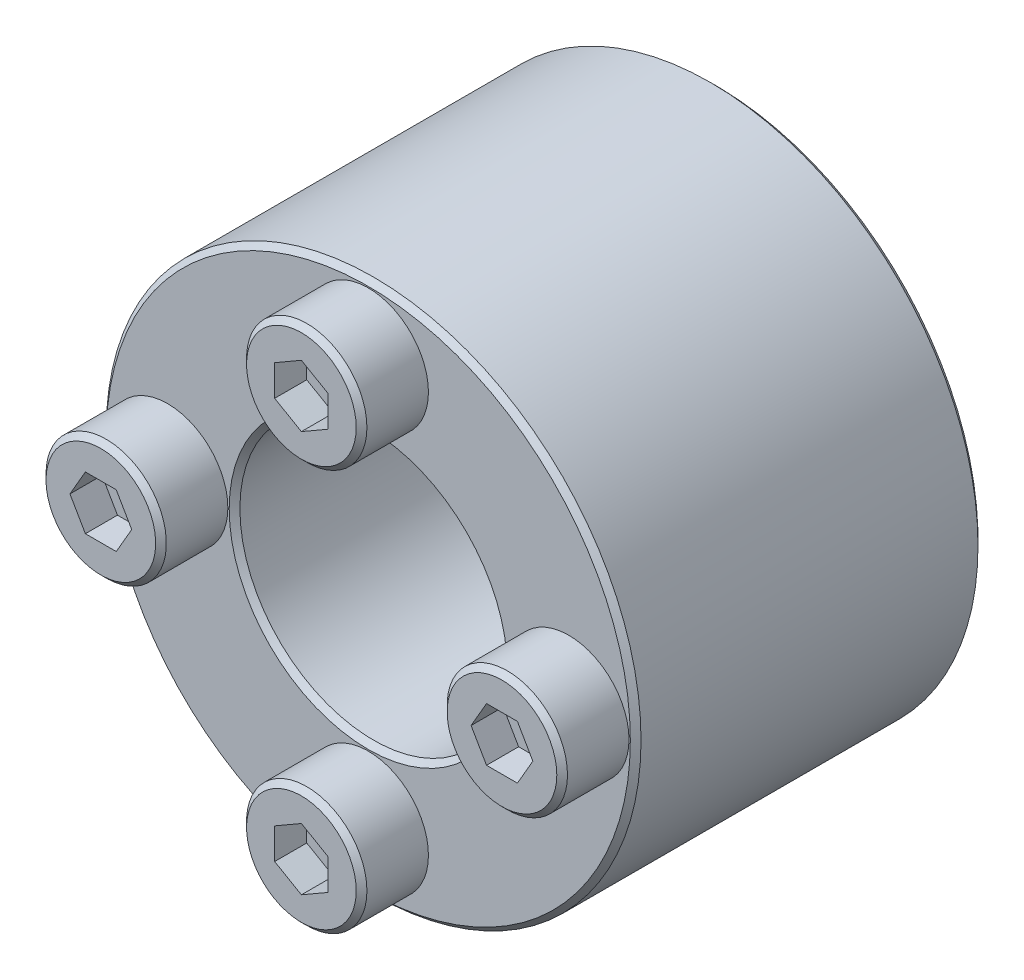
from build123d import *

# Parameters (mm, degrees)
SKETCH_1_W                  = 10
SKETCH_1_H                  = 13
SKETCH_2_R                  = 2.25
EXTRUDE_1_DEPTH             = 2.5
CUT_EXTRUDE_1_DEPTH         = 1.2
SKETCH_4_R                  = 2.25
EXTRUDE_2_DEPTH             = 2.5
CUT_EXTRUDE_2_DEPTH         = 1.2
SKETCH_6_R                  = 2.25
EXTRUDE_3_DEPTH             = 2.5
CUT_EXTRUDE_3_DEPTH         = 1.2
SKETCH_8_R                  = 2.25
EXTRUDE_4_DEPTH             = 2.5
CUT_EXTRUDE_4_DEPTH         = 1.2
SKETCH_10_W                 = 1.1
SKETCH_10_H                 = 11
SKETCH_11_W                 = 1.1
SKETCH_11_H                 = 11
SKETCH_12_W                 = 1.1
SKETCH_12_H                 = 11
SKETCH_13_W                 = 1.1
SKETCH_13_H                 = 11
HOLE_WIZARD_10_0_10_1_D     = 10
HOLE_WIZARD_10_0_10_1_DEPTH = 15.5
CHAMFER_1_SIZE              = 0.2


with BuildPart() as part:
    # 草图1 → 旋转1 (revolve)
    with BuildSketch(Plane.XZ, mode=Mode.PRIVATE) as revolve_1_sk:
        with Locations((5, 6.5)):
            Rectangle(SKETCH_1_W, SKETCH_1_H)
    revolve(revolve_1_sk.sketch.rotate(Axis((0, 0, 13), (0, 0, -1)), 180), axis=Axis((0, 0, 13), (0, 0, -1)))

    # 草图2 → 凸台-拉伸1 (add)
    with BuildSketch(Plane.XY.offset(13)):
        with Locations((-7.5, 0)):
            Circle(SKETCH_2_R)
    extrude(amount=EXTRUDE_1_DEPTH)

    # 草图3 → 切除-拉伸1 (cut)
    with BuildSketch(Plane.XY.offset(15.5)):
        Polygon((-6.922649731, 1), (-8.077350269, 1), (-8.654700538, 0), (-8.077350269, -1), (-6.922649731, -1), (-6.345299462, 0), align=None)
    extrude(amount=-CUT_EXTRUDE_1_DEPTH, mode=Mode.SUBTRACT)

    # 草图4 → 凸台-拉伸2 (add)
    with BuildSketch(Plane.XY.offset(13)):
        with Locations((0, -7.5)):
            Circle(SKETCH_4_R)
    extrude(amount=EXTRUDE_2_DEPTH)

    # 草图5 → 切除-拉伸2 (cut)
    with BuildSketch(Plane.XY.offset(15.5)):
        Polygon((-1, -6.922649731), (-1, -8.077350269), (0, -8.654700538), (1, -8.077350269), (1, -6.922649731), (0, -6.345299462), align=None)
    extrude(amount=-CUT_EXTRUDE_2_DEPTH, mode=Mode.SUBTRACT)

    # 草图6 → 凸台-拉伸3 (add)
    with BuildSketch(Plane.XY.offset(13)):
        with Locations((7.5, 0)):
            Circle(SKETCH_6_R)
    extrude(amount=EXTRUDE_3_DEPTH)

    # 草图7 → 切除-拉伸3 (cut)
    with BuildSketch(Plane.XY.offset(15.5)):
        Polygon((6.922649731, -1), (8.077350269, -1), (8.654700538, 0), (8.077350269, 1), (6.922649731, 1), (6.345299462, 0), align=None)
    extrude(amount=-CUT_EXTRUDE_3_DEPTH, mode=Mode.SUBTRACT)

    # 草图8 → 凸台-拉伸4 (add)
    with BuildSketch(Plane.XY.offset(13)):
        with Locations((0, 7.5)):
            Circle(SKETCH_8_R)
    extrude(amount=EXTRUDE_4_DEPTH)

    # 草图9 → 切除-拉伸4 (cut)
    with BuildSketch(Plane.XY.offset(15.5)):
        Polygon((1, 6.922649731), (1, 8.077350269), (0, 8.654700538), (-1, 8.077350269), (-1, 6.922649731), (0, 6.345299462), align=None)
    extrude(amount=-CUT_EXTRUDE_4_DEPTH, mode=Mode.SUBTRACT)

    # 草图10 → 切除-旋转1 (revolve, cut)
    with BuildSketch(Plane(origin=(0, 7.5, 0), x_dir=(1, 0, 0), z_dir=(0, 1, 0))):
        with Locations((0.55, -7.5)):
            Rectangle(SKETCH_10_W, SKETCH_10_H)
    revolve(axis=Axis((0, 7.5, 2), (0, 0, 1)), mode=Mode.SUBTRACT)

    # 草图11 → 切除-旋转2 (revolve, cut)
    with BuildSketch(Plane(origin=(0, 0, 0), x_dir=(1, 0, 0), z_dir=(0, 1, 0))):
        with Locations((8.05, -7.5)):
            Rectangle(SKETCH_11_W, SKETCH_11_H)
    revolve(axis=Axis((7.5, 0, 2), (0, 0, 1)), mode=Mode.SUBTRACT)

    # 草图12 → 切除-旋转3 (revolve, cut)
    with BuildSketch(Plane(origin=(0, -7.5, 0), x_dir=(1, 0, 0), z_dir=(0, 1, 0))):
        with Locations((0.55, -7.5)):
            Rectangle(SKETCH_12_W, SKETCH_12_H)
    revolve(axis=Axis((0, -7.5, 2), (0, 0, 1)), mode=Mode.SUBTRACT)

    # 草图13 → 切除-旋转4 (revolve, cut)
    with BuildSketch(Plane(origin=(0, 0, 0), x_dir=(1, 0, 0), z_dir=(0, 1, 0))):
        with Locations((-6.95, -7.5)):
            Rectangle(SKETCH_13_W, SKETCH_13_H)
    revolve(axis=Axis((-7.5, 0, 2), (0, 0, 1)), mode=Mode.SUBTRACT)

    # Ø10.0 (10) 直径孔1
    with Locations(Plane(origin=(0, 0, 0), x_dir=(-1, 0, 0), z_dir=(0, 0, -1))):
        with Locations((0, 0)):
            Hole(HOLE_WIZARD_10_0_10_1_D / 2, depth=HOLE_WIZARD_10_0_10_1_DEPTH)

    # 倒角1
    chamfer_1_edges = [part.edges().sort_by_distance(p)[0] for p in [
        (-9.75, 0, 15.5),
        (-5, 0, 13),
        (-5, 0, 0),
        (-2.25, -7.5, 15.5),
        (10, 0, 0),
        (10, 0, 13),
        (5.25, 0, 15.5),
        (-2.25, 7.5, 15.5),
    ]]
    chamfer(chamfer_1_edges, length=CHAMFER_1_SIZE)


solid = part.part
